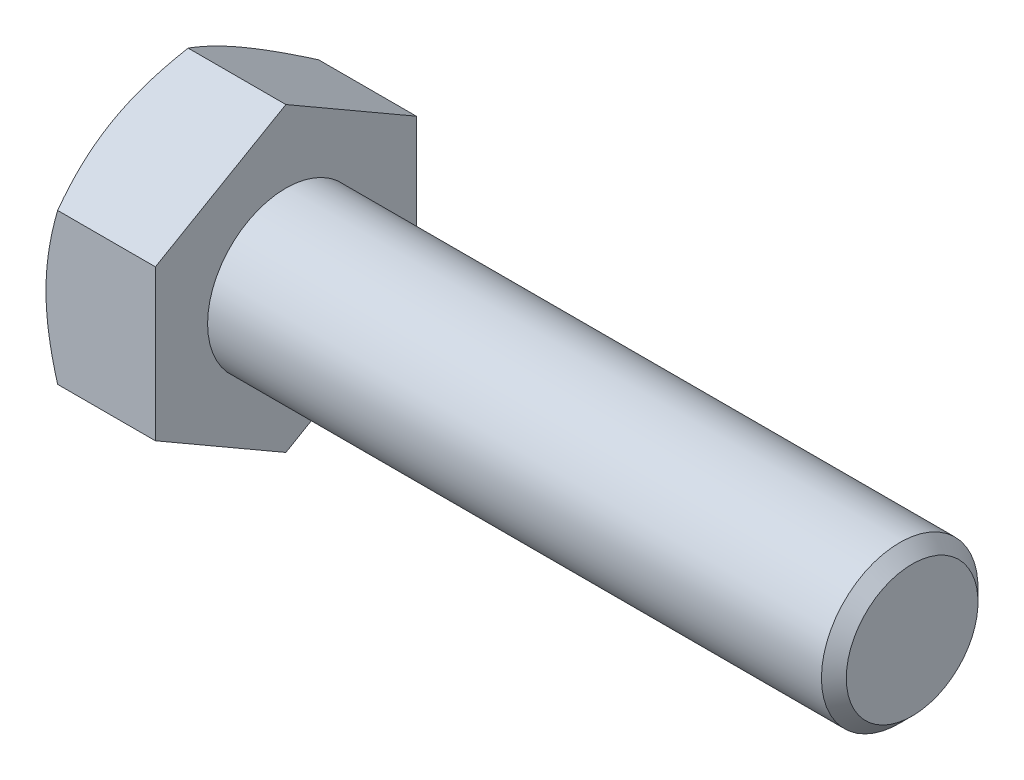
from build123d import *

# Parameters (mm, degrees)
BASEHEAD_DEPTH = 13.3096


with BuildPart() as part:
    # Sketch1 → BaseHead (new body)
    with BuildSketch(Plane(origin=(0, 0, 0), x_dir=(0, 0, -1), z_dir=(1, 0, 0))):
        Polygon((15.875, 9.165435523), (15.875, -9.165435523), (0, -18.330871047), (-15.875, -9.165435523), (-15.875, 9.165435523), (0, 18.330871047), align=None)
    extrude(amount=BASEHEAD_DEPTH)

    # BodySke → BaseBody (revolve)
    with BuildSketch(Plane.XY, mode=Mode.PRIVATE) as basebody_sk:
        Polygon((0, 0), (89.5096, 0), (89.5096, 8.01243), (87.99703, 9.525), (0, 9.525), align=None)
    revolve(basebody_sk.sketch.rotate(Axis((0, 0, 0), (1, 0, 0)), 90), axis=Axis((0, 0, 0), (1, 0, 0)))

    # Sketch3 → HeadChamfer (revolve, cut)
    with BuildSketch(Plane.XY):
        Polygon((0, 15.875), (5.084072019, 24.680871047), (5.084072019, 31.030871047), (-12.7, 31.030871047), (-12.7, 15.875), align=None)
    revolve(axis=Axis((0, 0, 0), (1, 0, 0)), mode=Mode.SUBTRACT)


solid = part.part
